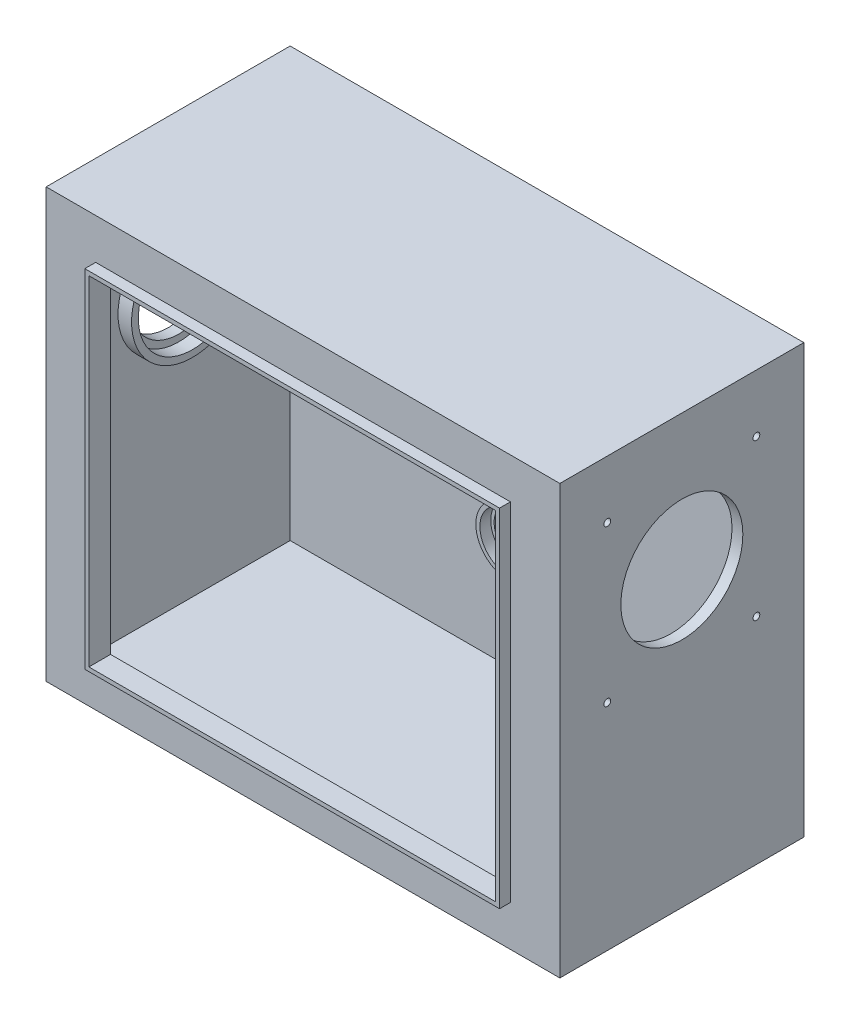
from build123d import *

# Parameters (mm, degrees)
CROQUIS1_W               = 379
CROQUIS1_H               = 316
SALIENTE_EXTRUIR1_DEPTH  = 180
VACIADO1_T               = -8
CROQUIS2_R               = 35
CORTAR_EXTRUIR4_DEPTH    = 20
CROQUIS4_R               = 45
CROQUIS4_R_2             = 40
SALIENTE_EXTRUIR4_DEPTH  = 10
CORTAR_EXTRUIR6_START    = -10
CROQUIS6_R               = 45
CORTAR_EXTRUIR6_DEPTH    = 10
CROQUIS7_R               = 24
CROQUIS7_R_2             = 21
SALIENTE_EXTRUIR9_DEPTH  = 18
CROQUIS11_W              = 363
CROQUIS11_H              = 300
CROQUIS11_W_2            = 300
CROQUIS11_H_2            = 250
SALIENTE_EXTRUIR10_DEPTH = 8
CROQUIS12_W              = 306
CROQUIS12_H              = 256
CROQUIS12_W_2            = 300
CROQUIS12_H_2            = 250
SALIENTE_EXTRUIR11_DEPTH = 8
CROQUIS20_R              = 21
CROQUIS20_R_2            = 18.5
SALIENTE_EXTRUIR19_DEPTH = 10
TALADRO_ROSCADO_M63_D    = 5


with BuildPart() as part:
    # Croquis1 → Saliente-Extruir1 (new body)
    with BuildSketch(Plane.XY):
        Rectangle(CROQUIS1_W, CROQUIS1_H)
    extrude(amount=SALIENTE_EXTRUIR1_DEPTH)

    # Vaciado1
    vaciado1_openings = [part.faces().sort_by_distance(p)[0] for p in [
        (0, 0, 180),
    ]]
    offset(amount=VACIADO1_T, openings=vaciado1_openings, kind=Kind.INTERSECTION)

    # Croquis2 → Cortar-Extruir4 (cut)
    with BuildSketch(Plane.ZY.offset(189.5)):
        with Locations((90, 58)):
            Circle(CROQUIS2_R)
    extrude(amount=-CORTAR_EXTRUIR4_DEPTH, mode=Mode.SUBTRACT)

    # Croquis4 → Saliente-Extruir4 (add)
    with BuildSketch(Plane(origin=(-181.5, 0, 0), x_dir=(0, 0, -1), z_dir=(1, 0, 0))):
        with Locations((-90, 58)):
            Circle(CROQUIS4_R)
        with Locations((-90, 58)):
            Circle(CROQUIS4_R_2, mode=Mode.SUBTRACT)
    extrude(amount=SALIENTE_EXTRUIR4_DEPTH)

    # Croquis6 → Cortar-Extruir6 (cut)
    with BuildSketch(Plane(origin=(189.5, 0, 0), x_dir=(0, 0, -1), z_dir=(1, 0, 0)).offset(CORTAR_EXTRUIR6_START)):
        with Locations((-90, 58)):
            Circle(CROQUIS6_R)
    extrude(amount=CORTAR_EXTRUIR6_DEPTH, mode=Mode.SUBTRACT)

    # Croquis7 → Saliente-Extruir9 (add)
    with BuildSketch(Plane.XY.offset(8)):
        with Locations(Location((-2.5, -53, 0), (0, 0, 180))):
            Circle(CROQUIS7_R)
        with Locations((-2.5, -53)):
            Circle(CROQUIS7_R_2, mode=Mode.SUBTRACT)
    extrude(amount=SALIENTE_EXTRUIR9_DEPTH)

    # Croquis11 → Saliente-Extruir10 (add)
    with BuildSketch(Plane.XY.offset(180)):
        Rectangle(CROQUIS11_W, CROQUIS11_H)
        Rectangle(CROQUIS11_W_2, CROQUIS11_H_2, mode=Mode.SUBTRACT)
    extrude(amount=-SALIENTE_EXTRUIR10_DEPTH)

    # Croquis12 → Saliente-Extruir11 (add)
    with BuildSketch(Plane.XY.offset(180)):
        Rectangle(CROQUIS12_W, CROQUIS12_H)
        Rectangle(CROQUIS12_W_2, CROQUIS12_H_2, mode=Mode.SUBTRACT)
    extrude(amount=SALIENTE_EXTRUIR11_DEPTH)

    # Croquis20 → Saliente-Extruir19 (add)
    with BuildSketch(Plane.XY.offset(8)):
        with Locations((-2.5, -53)):
            Circle(CROQUIS20_R)
        with Locations((-2.5, -53)):
            Circle(CROQUIS20_R_2, mode=Mode.SUBTRACT)
    extrude(amount=SALIENTE_EXTRUIR19_DEPTH)

    # Taladro roscado M63 (through all)
    with Locations(Plane(origin=(-189.5, 115.5, 35), x_dir=(0, 0, -1), z_dir=(-1, 0, 0))):
        with Locations((0, 0), (-110, 0), (-110, 115), (0, 115)):
            Hole(TALADRO_ROSCADO_M63_D / 2)


solid = part.part
